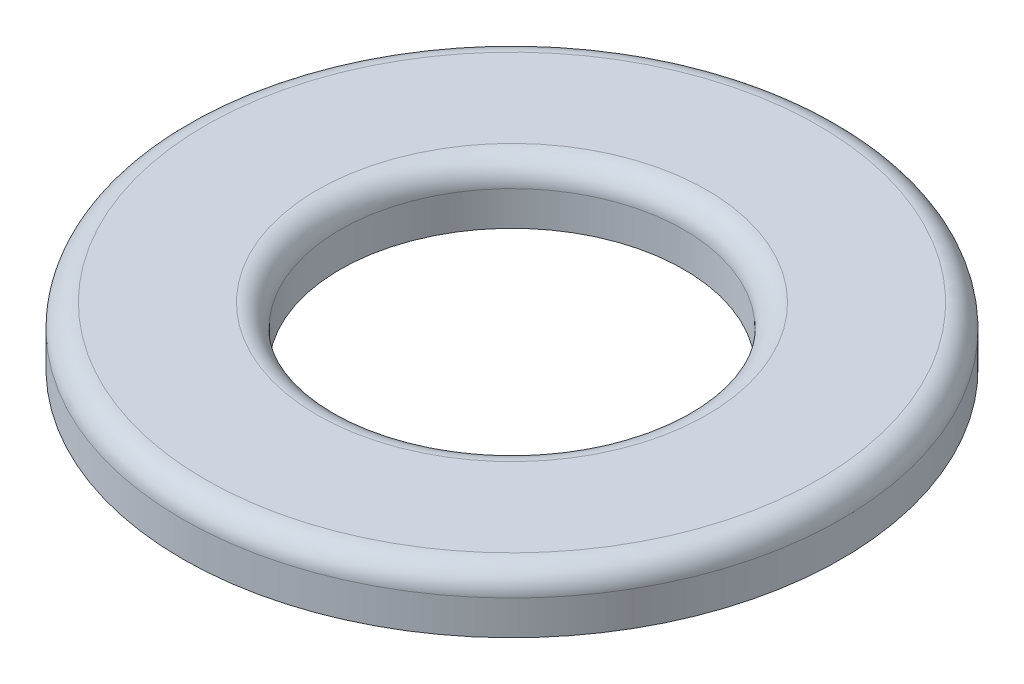
from build123d import *

# Parameters (mm, degrees)
SKETCH1_R           = 2.875
SKETCH1_R_2         = 1.5
BOSS_EXTRUDE1_DEPTH = 0.5
FILLET1_R           = 0.2


with BuildPart() as part:
    # Sketch1 → Boss-Extrude1 (new body)
    with BuildSketch(Plane(origin=(0, 0, 0), x_dir=(1, 0, 0), z_dir=(0, 1, 0))):
        with Locations(Location((0, 0, 0), (0, 0, 270))):
            Circle(SKETCH1_R)
        with Locations(Location((0, 0, 0), (0, 0, 270))):
            Circle(SKETCH1_R_2, mode=Mode.SUBTRACT)
    extrude(amount=BOSS_EXTRUDE1_DEPTH)

    # Fillet1
    fillet1_edges = [part.edges().sort_by_distance(p)[0] for p in [
        (0, 0.5, -2.875),
        (0, 0.5, -1.5),
    ]]
    fillet(fillet1_edges, radius=FILLET1_R)


solid = part.part
